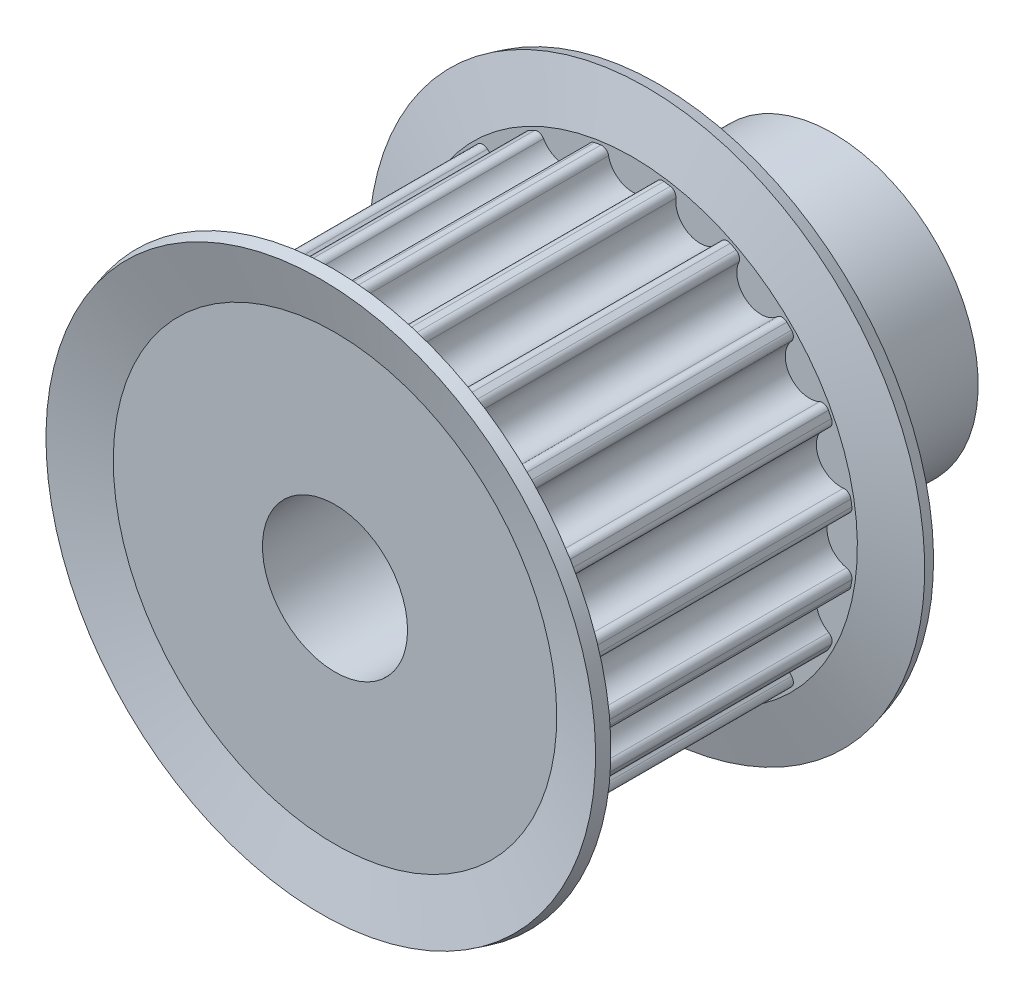
from build123d import *

# Parameters (mm, degrees)
KUGGLUCKA_DEPTH  = 12.8
CIRPATTERN_COUNT = 20
RITNING_4_R      = 3
AXELH_L_DEPTH    = 29.554110475


with BuildPart() as part:
    # Ritning 1 → Kugghjulsämne (revolve)
    with BuildSketch(Plane(origin=(0, 0, 0), x_dir=(0, 0, -1), z_dir=(1, 0, 0))):
        Polygon((6.4, 4.585), (6.4, 1.415), (14.2, 1.415), (14.2, -4.585), (6.4, -4.585), (-6.4, -4.585), (-6.4, 4.585), align=None)
    revolve(axis=Axis((0, -4.585, -14.2), (0, 0, 1)))

    # Ritning 2 → Kugglucka (cut)
    with BuildSketch(Plane.XY.offset(6.4)):
        with BuildLine():
            Line((1.302513782, 4.492023623), (1.302513782, 5.612023623))
            Line((1.302513782, 5.612023623), (-1.302513782, 5.612023623))
            Line((-1.302513782, 5.612023623), (-1.302513782, 4.492023623))
            ThreePointArc((-1.302513782, 4.492023623), (-1.099792064, 4.443429711), (-0.985557985, 4.269050704))
            ThreePointArc((-0.985557985, 4.269050704), (0, 3.465), (0.985557985, 4.269050704))
            ThreePointArc((0.985557985, 4.269050704), (1.099792064, 4.443429711), (1.302513782, 4.492023623))
        make_face()
    kugglucka = extrude(amount=-KUGGLUCKA_DEPTH, mode=Mode.SUBTRACT)

    # CirPattern: Kugglucka ×20 about axis
    cirpattern_axis = Axis((0, -4.585, 0), (0, 0, 1))
    for i in range(1, CIRPATTERN_COUNT):
        add(kugglucka.rotate(cirpattern_axis, i * 360 / CIRPATTERN_COUNT), mode=Mode.SUBTRACT)

    # Ritning 3 → Flänsar (revolve)
    with BuildSketch(Plane(origin=(0, 0, 0), x_dir=(0, 0, -1), z_dir=(1, 0, 0))):
        Polygon((-5.9, 3.0625), (-6.4, 3.0625), (-6.4, 4.585), (-6.988423234, 6.781025404), (-6.488423234, 6.915), (-5.9, 4.718974596), align=None)
        Polygon((5.9, 3.0625), (6.4, 3.0625), (6.4, 4.585), (6.988423234, 6.781025404), (6.488423234, 6.915), (5.9, 4.718974596), align=None)
    revolve(axis=Axis((0, -4.585, -6.4), (0, 0, 1)))

    # Ritning 4 → Axelhål (cut, through all)
    with BuildSketch(Plane.XY.offset(6.4)):
        with Locations((0, -4.585)):
            Circle(RITNING_4_R)
    extrude(amount=-AXELH_L_DEPTH, mode=Mode.SUBTRACT)


solid = part.part
